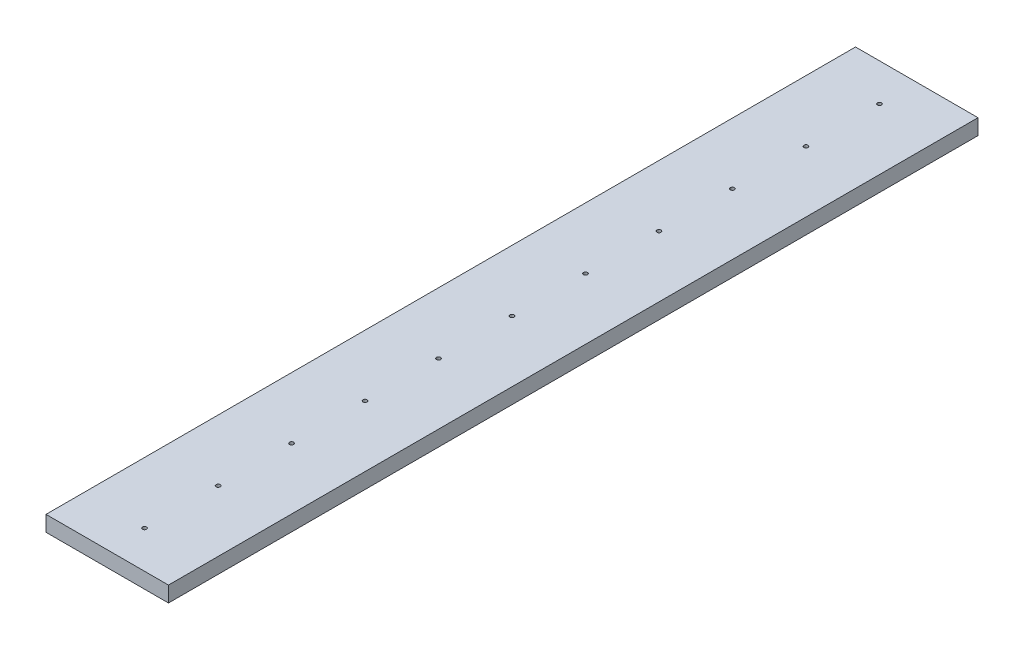
from build123d import *

# Parameters (mm, degrees)
SKETCH2_W                 = 100
SKETCH2_H                 = 661
BOSS_EXTRUDE1_DEPTH       = 12.7
M4X0_7_TAPPED_HOLE1_D     = 3.3
M4X0_7_TAPPED_HOLE1_DEPTH = 10.1
M4X0_7_TAPPED_HOLE1_TIP   = 0.991420021


with BuildPart() as part:
    # Sketch2 → Boss-Extrude1 (new body)
    with BuildSketch(Plane(origin=(0, 0, 0), x_dir=(1, 0, 0), z_dir=(0, 1, 0))):
        Rectangle(SKETCH2_W, SKETCH2_H)
    extrude(amount=BOSS_EXTRUDE1_DEPTH)

    # M4x0.7 Tapped Hole1
    with Locations(Plane(origin=(0, 12.7, 0), x_dir=(1, 0, 0), z_dir=(0, 1, 0))):
        with Locations((0, -300), (0, -240), (0, -180), (0, -120), (0, -60), (0, 0), (0, 60), (0, 120), (0, 180), (0, 240), (0, 300)):
            Hole(M4X0_7_TAPPED_HOLE1_D / 2, depth=M4X0_7_TAPPED_HOLE1_DEPTH)
            with Locations((0, 0, -(M4X0_7_TAPPED_HOLE1_DEPTH + M4X0_7_TAPPED_HOLE1_TIP / 2))):  # 118° drill point
                Cone(0, M4X0_7_TAPPED_HOLE1_D / 2, M4X0_7_TAPPED_HOLE1_TIP, mode=Mode.SUBTRACT)


solid = part.part
